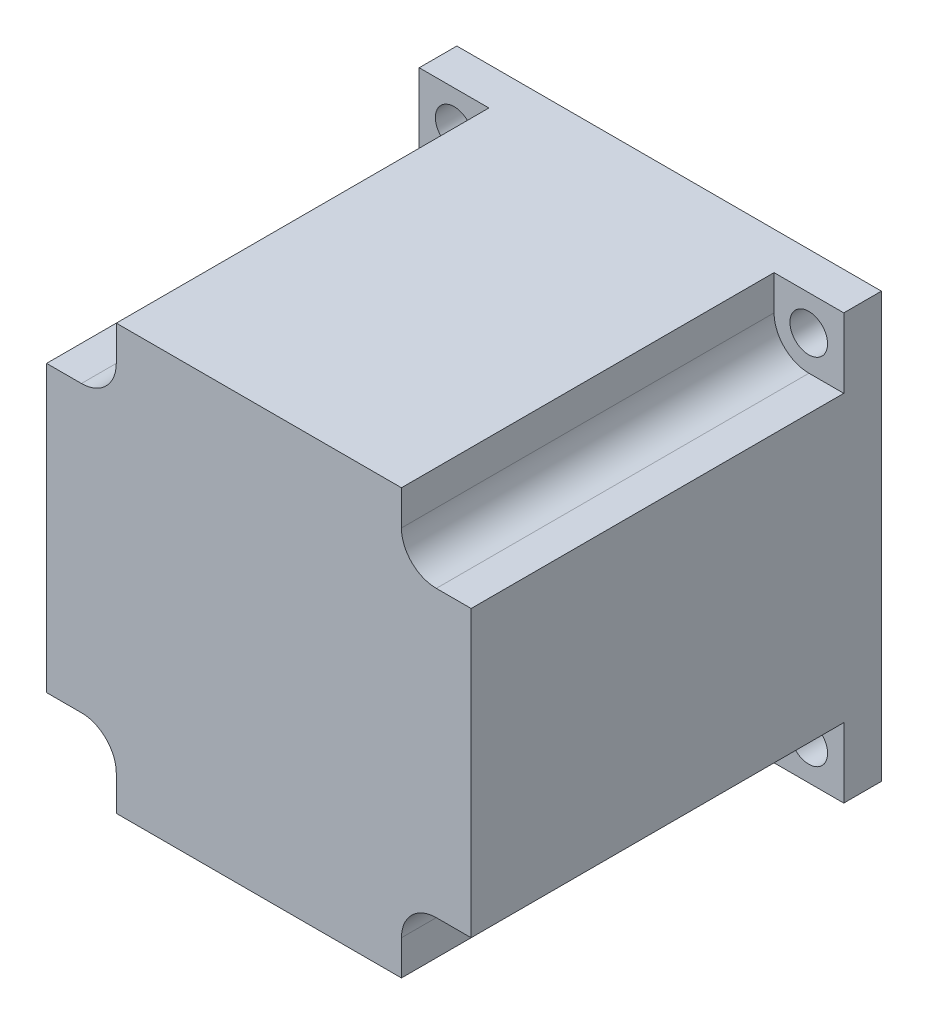
from build123d import *

# Parameters (mm, degrees)
SKETCH_1_W          = 56.4
SKETCH_1_H          = 56.4
SKETCH_1_R          = 2.5
EXTRUDE_1_DEPTH     = 54.5
SKETCH_2_R          = 4
EXTRUDE_2_DEPTH     = 22
CUT_EXTRUDE_START   = -18
CUT_EXTRUDE_1_DEPTH = 18
SKETCH_4_R          = 19.05
EXTRUDE_3_DEPTH     = 2
CUT_EXTRUDE_2_DEPTH = 49.5


with BuildPart() as part:
    # 草图1 → 凸台-拉伸1 (new body)
    with BuildSketch(Plane.XY):
        Rectangle(SKETCH_1_W, SKETCH_1_H)
        with Locations((23.55, -23.55)):
            Circle(SKETCH_1_R, mode=Mode.SUBTRACT)
        with Locations((-23.55, -23.55)):
            Circle(SKETCH_1_R, mode=Mode.SUBTRACT)
        with Locations((23.55, 23.55)):
            Circle(SKETCH_1_R, mode=Mode.SUBTRACT)
        with Locations((-23.55, 23.55)):
            Circle(SKETCH_1_R, mode=Mode.SUBTRACT)
    extrude(amount=EXTRUDE_1_DEPTH)

    # 草图2 → 凸台-拉伸2 (add)
    with BuildSketch(Plane(origin=(0, 0, 0), x_dir=(-1, 0, 0), z_dir=(0, 0, -1))):
        Circle(SKETCH_2_R)
    extrude(amount=EXTRUDE_2_DEPTH)

    # 草图3 → 切除-拉伸1 (cut)
    with BuildSketch(Plane(origin=(0, 0, -22), x_dir=(-1, 0, 0), z_dir=(0, 0, -1)).offset(CUT_EXTRUDE_START)):
        with BuildLine():
            Line((1.936491673, -3.5), (-1.936491673, -3.5))
            ThreePointArc((-1.936491673, -3.5), (0, -4), (1.936491673, -3.5))
        make_face()
    extrude(amount=CUT_EXTRUDE_1_DEPTH, mode=Mode.SUBTRACT)

    # 草图4 → 凸台-拉伸3 (add)
    with BuildSketch(Plane(origin=(0, 0, 0), x_dir=(-1, 0, 0), z_dir=(0, 0, -1))):
        Circle(SKETCH_4_R)
    extrude(amount=EXTRUDE_3_DEPTH)

    # 草图5 → 切除-拉伸2 (cut)
    with BuildSketch(Plane.XY.offset(54.5)):
        with BuildLine():
            Line((23.57, 18.94), (28.2, 18.94))
            Line((28.2, 18.94), (28.2, 28.2))
            Line((28.2, 28.2), (18.94, 28.2))
            Line((18.94, 28.2), (18.94, 23.57))
            ThreePointArc((18.94, 23.57), (20.296095603, 20.296095603), (23.57, 18.94))
        make_face()
        with BuildLine():
            Line((18.94, -23.57), (18.94, -28.2))
            Line((18.94, -28.2), (28.2, -28.2))
            Line((28.2, -28.2), (28.2, -18.94))
            Line((28.2, -18.94), (23.57, -18.94))
            ThreePointArc((23.57, -18.94), (20.296095603, -20.296095603), (18.94, -23.57))
        make_face()
        with BuildLine():
            Line((-23.57, -18.94), (-28.2, -18.94))
            Line((-28.2, -18.94), (-28.2, -28.2))
            Line((-28.2, -28.2), (-18.94, -28.2))
            Line((-18.94, -28.2), (-18.94, -23.57))
            ThreePointArc((-18.94, -23.57), (-20.296095603, -20.296095603), (-23.57, -18.94))
        make_face()
        with BuildLine():
            Line((-18.94, 23.57), (-18.94, 28.2))
            Line((-18.94, 28.2), (-28.2, 28.2))
            Line((-28.2, 28.2), (-28.2, 18.94))
            Line((-28.2, 18.94), (-23.57, 18.94))
            ThreePointArc((-23.57, 18.94), (-20.296095603, 20.296095603), (-18.94, 23.57))
        make_face()
    extrude(amount=-CUT_EXTRUDE_2_DEPTH, mode=Mode.SUBTRACT)


solid = part.part
